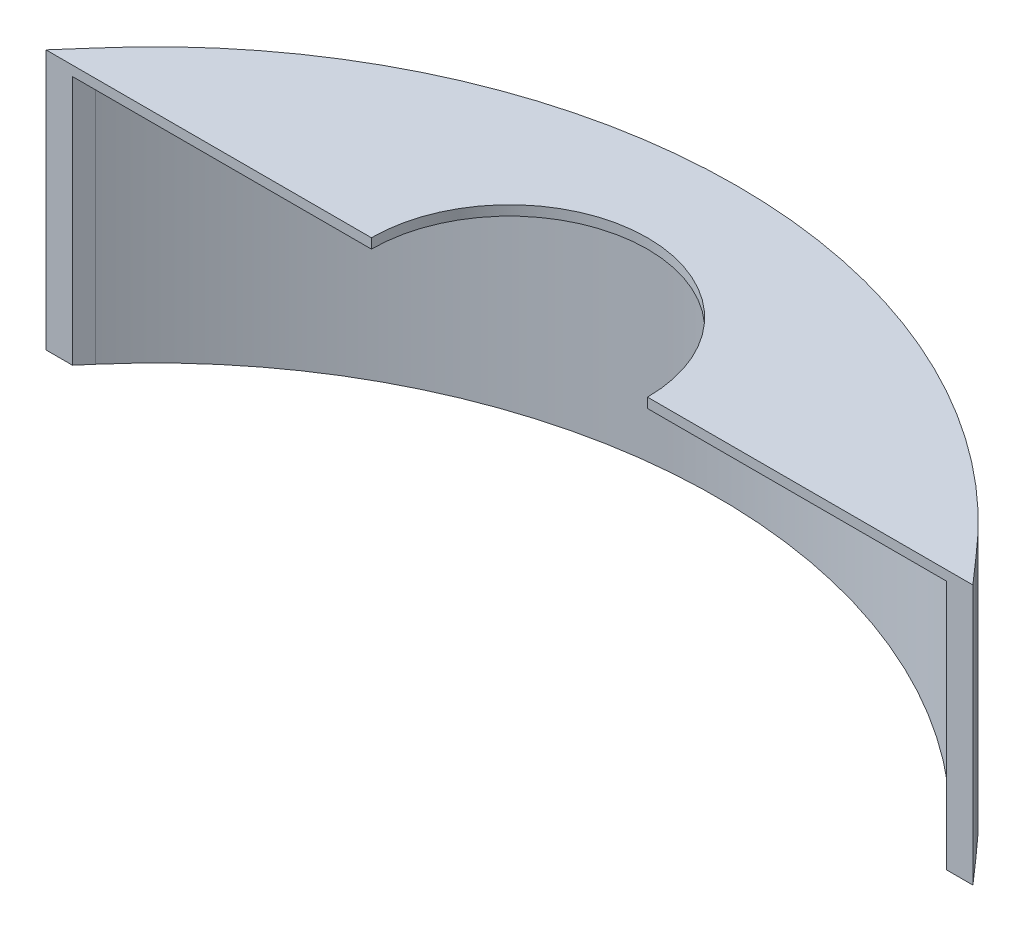
from build123d import *

# Parameters (mm, degrees)
BOSS_EXTRUDE1_DEPTH = 63.4
BOSS_EXTRUDE2_DEPTH = 2.5
BOSS_EXTRUDE3_DEPTH = 63.4
SKETCH4_R           = 35
CUT_EXTRUDE1_DEPTH  = 152.762941692


with BuildPart() as part:
    # Sketch1 → Boss-Extrude1 (new body)
    with BuildSketch(Plane(origin=(0, 0, 0), x_dir=(1, 0, 0), z_dir=(0, 1, 0))):
        with BuildLine():
            Line((-108.164150322, 11.807033697), (-113.772816425, 5.431031062))
            Line((-113.772816425, 5.431031062), (-110.443441346, 5.431031062))
            Line((-110.443441346, 5.431031062), (-106.2683534, 10.177323898))
            ThreePointArc((-106.2683534, 10.177323898), (3.7316466, 60.67425262), (113.7316466, 10.177323898))
            Line((113.7316466, 10.177323898), (117.906734545, 5.431031062))
            Line((117.906734545, 5.431031062), (121.236109625, 5.431031062))
            Line((121.236109625, 5.431031062), (115.627443521, 11.807033697))
            ThreePointArc((115.627443521, 11.807033697), (3.7316466, 63.17425262), (-108.164150322, 11.807033697))
        make_face()
    extrude(amount=BOSS_EXTRUDE1_DEPTH)

    # Sketch2 → Boss-Extrude2 (add)
    with BuildSketch(Plane(origin=(0, 63.4, 0), x_dir=(1, 0, 0), z_dir=(0, 1, 0))):
        with BuildLine():
            Line((-113.772816425, 5.431031062), (121.236109625, 5.431031062))
            Line((121.236109625, 5.431031062), (115.627443521, 11.807033697))
            ThreePointArc((115.627443521, 11.807033697), (3.7316466, 63.17425262), (-108.164150322, 11.807033697))
            Line((-108.164150322, 11.807033697), (-113.772816425, 5.431031062))
        make_face()
    extrude(amount=BOSS_EXTRUDE2_DEPTH)

    # Sketch3 → Boss-Extrude3 (add)
    with BuildSketch(Plane(origin=(0, 0, 0), x_dir=(1, 0, 0), z_dir=(0, 1, 0))):
        with BuildLine():
            Line((-110.443441346, 5.431031062), (-106.2683534, 10.177323898))
            ThreePointArc((-106.2683534, 10.177323898), (3.7316466, 60.67425262), (113.7316466, 10.177323898))
            Line((113.7316466, 10.177323898), (117.906734545, 5.431031062))
            Line((117.906734545, 5.431031062), (114.515000518, 5.431031062))
            Line((114.515000518, 5.431031062), (111.835849678, 8.547614098))
            ThreePointArc((111.835849678, 8.547614098), (3.7316466, 58.17425262), (-104.372556479, 8.547614098))
            Line((-104.372556479, 8.547614098), (-107.051707318, 5.431031062))
            Line((-107.051707318, 5.431031062), (-110.443441346, 5.431031062))
        make_face()
    extrude(amount=BOSS_EXTRUDE3_DEPTH)

    # Sketch4 → Cut-Extrude1 (cut, through all)
    with BuildSketch(Plane(origin=(0, 65.9, 0), x_dir=(1, 0, 0), z_dir=(0, 1, 0))):
        with Locations((3.7316466, 5.431031062)):
            Circle(SKETCH4_R)
    extrude(amount=-CUT_EXTRUDE1_DEPTH, mode=Mode.SUBTRACT)


solid = part.part
